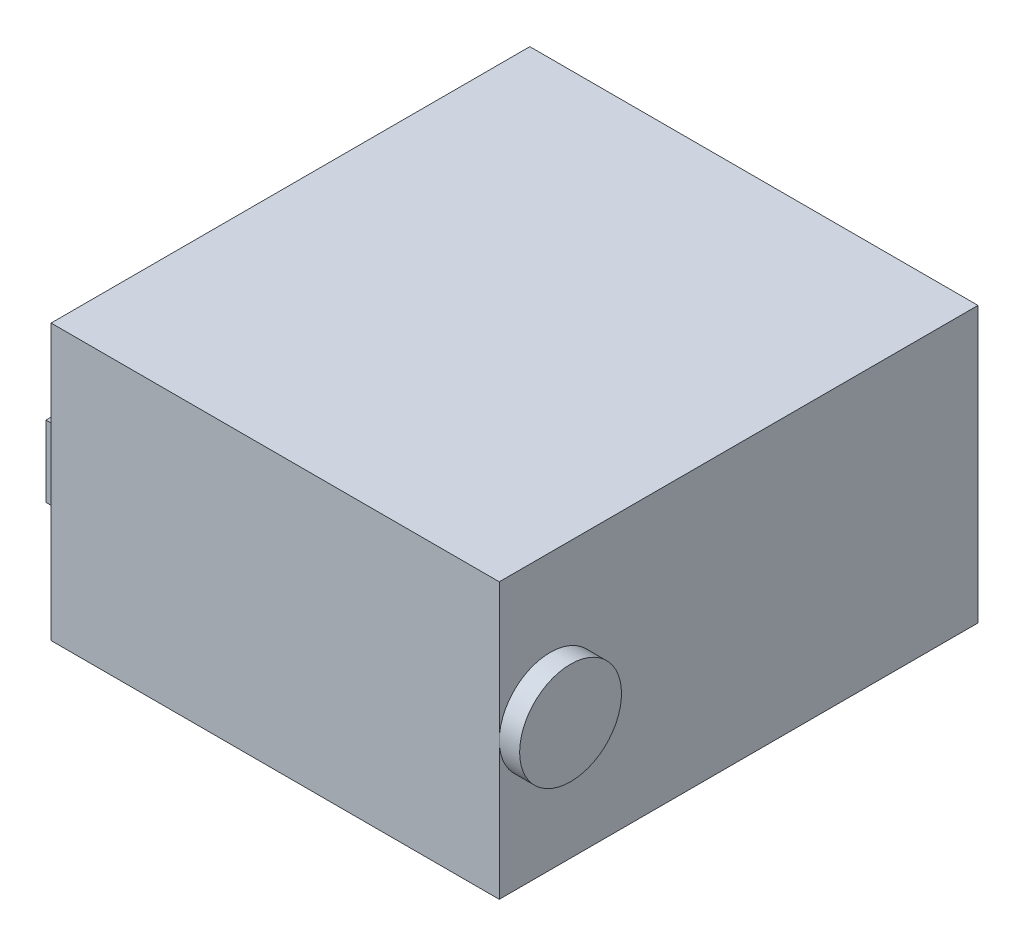
from build123d import *

# Parameters (mm, degrees)
SKETCH1_W           = 139.7
SKETCH1_H           = 149.225
BOSS_EXTRUDE1_DEPTH = 85.725
SKETCH2_W           = 49.2125
SKETCH2_H           = 22.225
BOSS_EXTRUDE2_DEPTH = 6.35
SKETCH3_R           = 15.875
BOSS_EXTRUDE3_DEPTH = 6.35


with BuildPart() as part:
    # Sketch1 → Boss-Extrude1 (new body)
    with BuildSketch(Plane(origin=(0, 0, 0), x_dir=(1, 0, 0), z_dir=(0, 1, 0))):
        with Locations((69.85, 74.6125)):
            Rectangle(SKETCH1_W, SKETCH1_H)
    extrude(amount=BOSS_EXTRUDE1_DEPTH)

    # Sketch2 → Boss-Extrude2 (add)
    with BuildSketch(Plane.ZY):
        with Locations((-29.36875, 42.8625)):
            Rectangle(SKETCH2_W, SKETCH2_H)
    extrude(amount=BOSS_EXTRUDE2_DEPTH)

    # Sketch3 → Boss-Extrude3 (add)
    with BuildSketch(Plane(origin=(139.7, 0, 0), x_dir=(0, 0, -1), z_dir=(1, 0, 0))):
        with Locations(Location((15.875, 42.8625, 0), (0, 0, 180))):
            Circle(SKETCH3_R)
    extrude(amount=BOSS_EXTRUDE3_DEPTH)


solid = part.part
